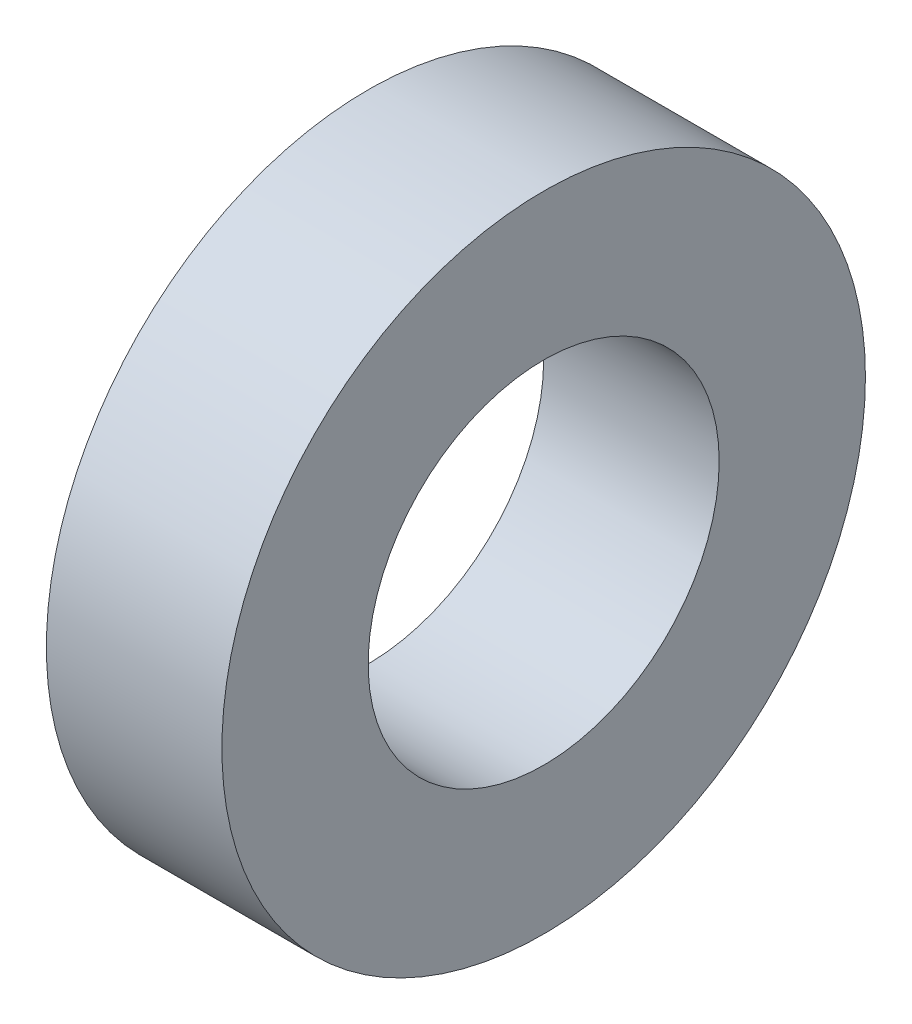
from build123d import *

# Parameters (mm, degrees)
SKETCH_1_R      = 5.5
SKETCH_1_R_2    = 3
EXTRUDE_1_DEPTH = 3


with BuildPart() as part:
    # 草图1 → 凸台-拉伸1 (new body)
    with BuildSketch(Plane(origin=(0, 0, 0), x_dir=(0, 0, -1), z_dir=(1, 0, 0))):
        Circle(SKETCH_1_R)
        Circle(SKETCH_1_R_2, mode=Mode.SUBTRACT)
    extrude(amount=EXTRUDE_1_DEPTH)


solid = part.part
